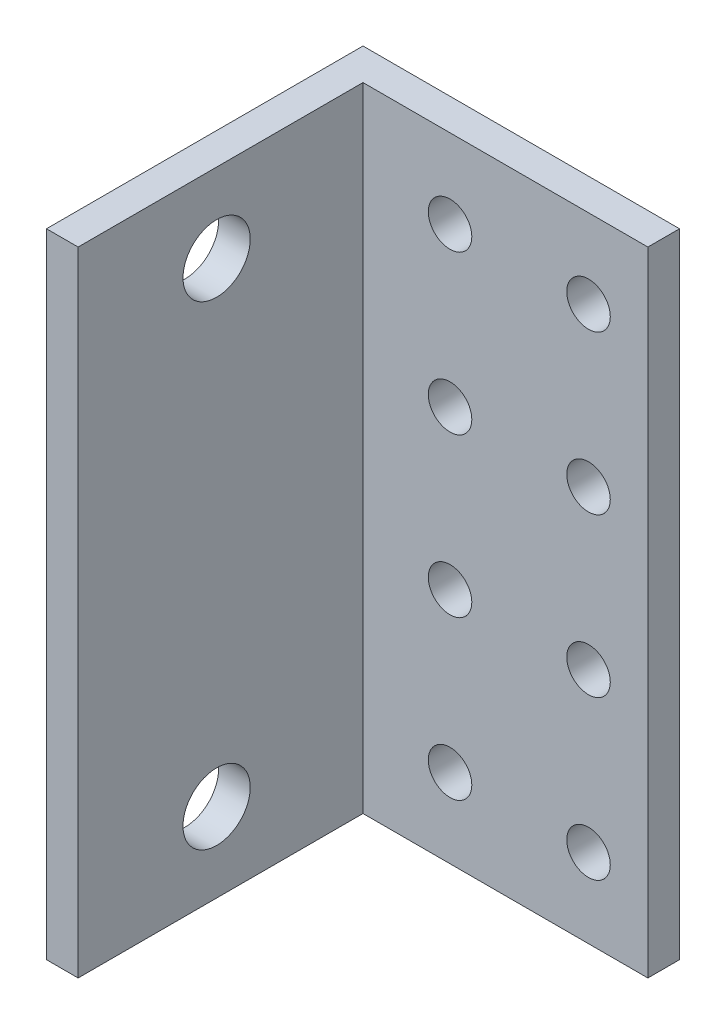
from build123d import *

# Parameters (mm, degrees)
BOSS_EXTRUDE1_DEPTH        = 80
F_5_5_5_5_DIAMETER_HOLE1_D = 5.5
F_8_5_8_5_DIAMETER_HOLE1_D = 8.5


with BuildPart() as part:
    # Sketch1 → Boss-Extrude1 (new body)
    with BuildSketch(Plane(origin=(0, 0, 0), x_dir=(1, 0, 0), z_dir=(0, 1, 0))):
        Polygon((0, 0), (40, 0), (40, -4), (4, -4), (4, -40), (0, -40), align=None)
    extrude(amount=BOSS_EXTRUDE1_DEPTH)

    # Ø5.5 (5.5) Diameter Hole1 (through all)
    with Locations(Plane.XY.offset(4)):
        with Locations((32.5, 70), (15, 70), (15, 50), (32.5, 50), (32.5, 30), (15, 30), (15, 10), (32.5, 10)):
            Hole(F_5_5_5_5_DIAMETER_HOLE1_D / 2)

    # Ø8.5 (8.5) Diameter Hole1 (through all)
    with Locations(Plane(origin=(4, 0, 0), x_dir=(0, 0, -1), z_dir=(1, 0, 0))):
        with Locations((-22.5, 70), (-22.5, 10)):
            Hole(F_8_5_8_5_DIAMETER_HOLE1_D / 2)


solid = part.part
